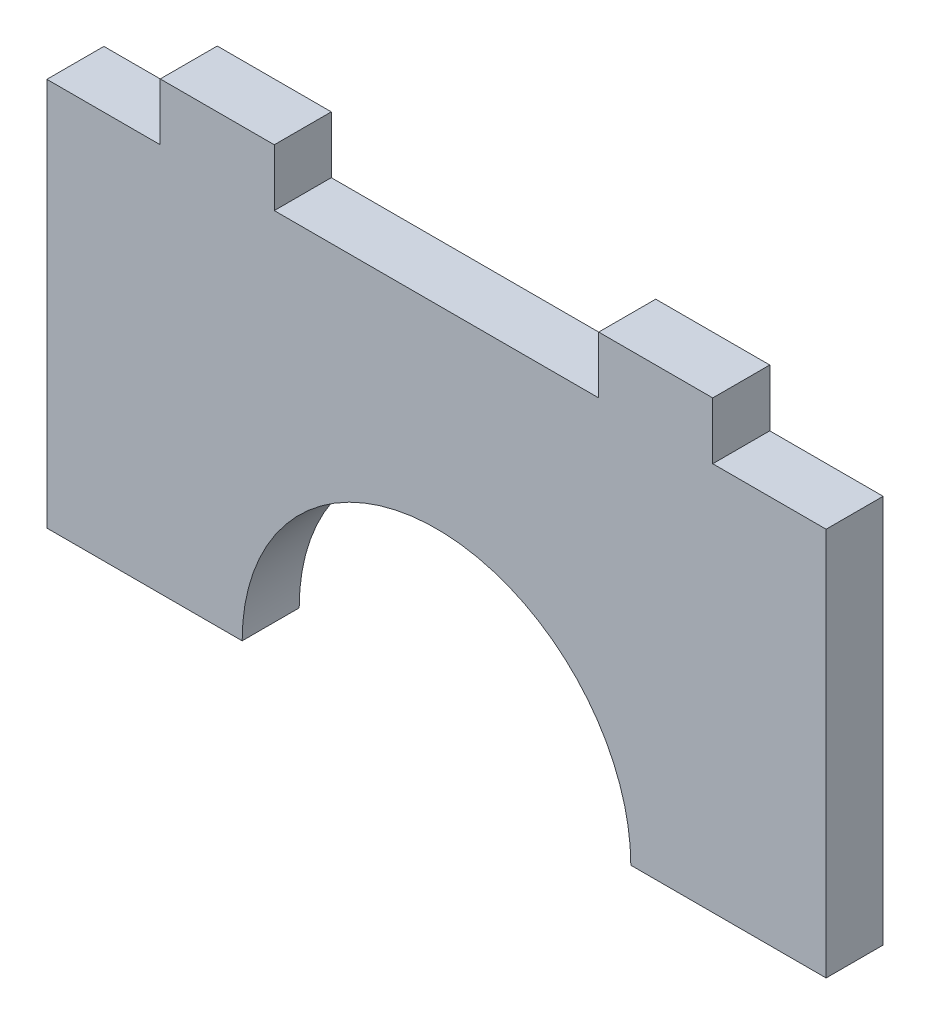
from build123d import *

# Parameters (mm, degrees)
BOSS_EXTRUDE1_DEPTH = 3


with BuildPart() as part:
    # Sketch1 → Boss-Extrude1 (new body)
    with BuildSketch(Plane.XY):
        with BuildLine():
            ThreePointArc((-10.225, -10.225), (0, 0), (10.225, -10.225))
            Line((10.225, -10.225), (20.5, -10.225))
            Line((20.5, -10.225), (20.5, 10.225))
            Line((20.5, 10.225), (14.535, 10.225))
            Line((14.535, 10.225), (14.535, 13.225))
            Line((14.535, 13.225), (8.535, 13.225))
            Line((8.535, 13.225), (8.535, 10.225))
            Line((8.535, 10.225), (-8.535, 10.225))
            Line((-8.535, 10.225), (-8.535, 13.225))
            Line((-8.535, 13.225), (-14.535, 13.225))
            Line((-14.535, 13.225), (-14.535, 10.225))
            Line((-14.535, 10.225), (-20.5, 10.225))
            Line((-20.5, 10.225), (-20.5, -10.225))
            Line((-20.5, -10.225), (-10.225, -10.225))
        make_face()
    extrude(amount=BOSS_EXTRUDE1_DEPTH)


solid = part.part
